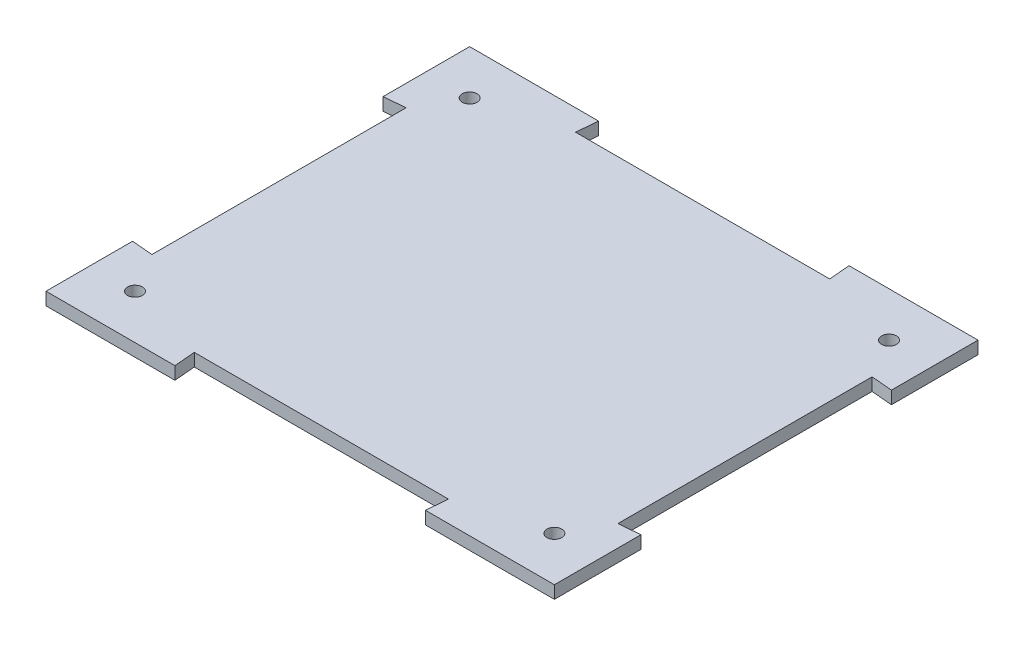
from build123d import *

# Parameters (mm, degrees)
SKETCH1_W           = 120
SKETCH1_H           = 100
PLATEFORM_DEPTH     = 3
CUT_ARMS_DEPTH      = 10
HOLES_SPACERS_REACH = 158.234
SKETCH6_R           = 1.75


with BuildPart() as part:
    # Sketch1 → plateform (new body)
    with BuildSketch(Plane(origin=(0, 0, 0), x_dir=(1, 0, 0), z_dir=(0, 1, 0))):
        with Locations((60, 50)):
            Rectangle(SKETCH1_W, SKETCH1_H)
    extrude(amount=PLATEFORM_DEPTH)

    # Sketch2 → cut_arms (cut)
    with BuildSketch(Plane(origin=(0, 3, 0), x_dir=(1, 0, 0), z_dir=(0, 1, 0))):
        Polygon((0, 79.562556682), (5, 80), (5, 20), (0, 20.437443318), align=None)
        Polygon((30.437443318, 100), (30, 95), (90, 95), (89.562556682, 100), align=None)
        Polygon((120, 79.562556682), (115, 80), (115, 20), (120, 20.437443318), align=None)
        Polygon((30.437443318, 0), (30, 5), (90, 5), (89.562556682, 0), align=None)
    extrude(amount=-CUT_ARMS_DEPTH, mode=Mode.SUBTRACT)

    # Sketch6 → holes_spacers (cut, up to next)
    with BuildSketch(Plane(origin=(0, 3, 0), x_dir=(1, 0, 0), z_dir=(0, 1, 0)), mode=Mode.PRIVATE) as holes_spacers_sk1:
        with Locations(Location((10.5, 89.5, 0), (0, 0, 270))):
            Circle(SKETCH6_R)
    holes_spacers_tool1 = extrude(holes_spacers_sk1.sketch, amount=-HOLES_SPACERS_REACH, mode=Mode.PRIVATE) & part.part
    # Sketch6 → holes_spacers (cut, up to next)
    with BuildSketch(Plane(origin=(0, 3, 0), x_dir=(1, 0, 0), z_dir=(0, 1, 0)), mode=Mode.PRIVATE) as holes_spacers_sk2:
        with Locations(Location((109.5, 89.5, 0), (0, 0, 270))):
            Circle(SKETCH6_R)
    holes_spacers_tool2 = extrude(holes_spacers_sk2.sketch, amount=-HOLES_SPACERS_REACH, mode=Mode.PRIVATE) & part.part
    # Sketch6 → holes_spacers (cut, up to next)
    with BuildSketch(Plane(origin=(0, 3, 0), x_dir=(1, 0, 0), z_dir=(0, 1, 0)), mode=Mode.PRIVATE) as holes_spacers_sk3:
        with Locations(Location((109.5, 10.5, 0), (0, 0, 270))):
            Circle(SKETCH6_R)
    holes_spacers_tool3 = extrude(holes_spacers_sk3.sketch, amount=-HOLES_SPACERS_REACH, mode=Mode.PRIVATE) & part.part
    # Sketch6 → holes_spacers (cut, up to next)
    with BuildSketch(Plane(origin=(0, 3, 0), x_dir=(1, 0, 0), z_dir=(0, 1, 0)), mode=Mode.PRIVATE) as holes_spacers_sk4:
        with Locations(Location((10.5, 10.5, 0), (0, 0, 270))):
            Circle(SKETCH6_R)
    holes_spacers_tool4 = extrude(holes_spacers_sk4.sketch, amount=-HOLES_SPACERS_REACH, mode=Mode.PRIVATE) & part.part
    add(holes_spacers_tool1.solids().sort_by_distance((10.5, 3, -89.5))[0], mode=Mode.SUBTRACT)
    add(holes_spacers_tool2.solids().sort_by_distance((109.5, 3, -89.5))[0], mode=Mode.SUBTRACT)
    add(holes_spacers_tool3.solids().sort_by_distance((109.5, 3, -10.5))[0], mode=Mode.SUBTRACT)
    add(holes_spacers_tool4.solids().sort_by_distance((10.5, 3, -10.5))[0], mode=Mode.SUBTRACT)


solid = part.part
